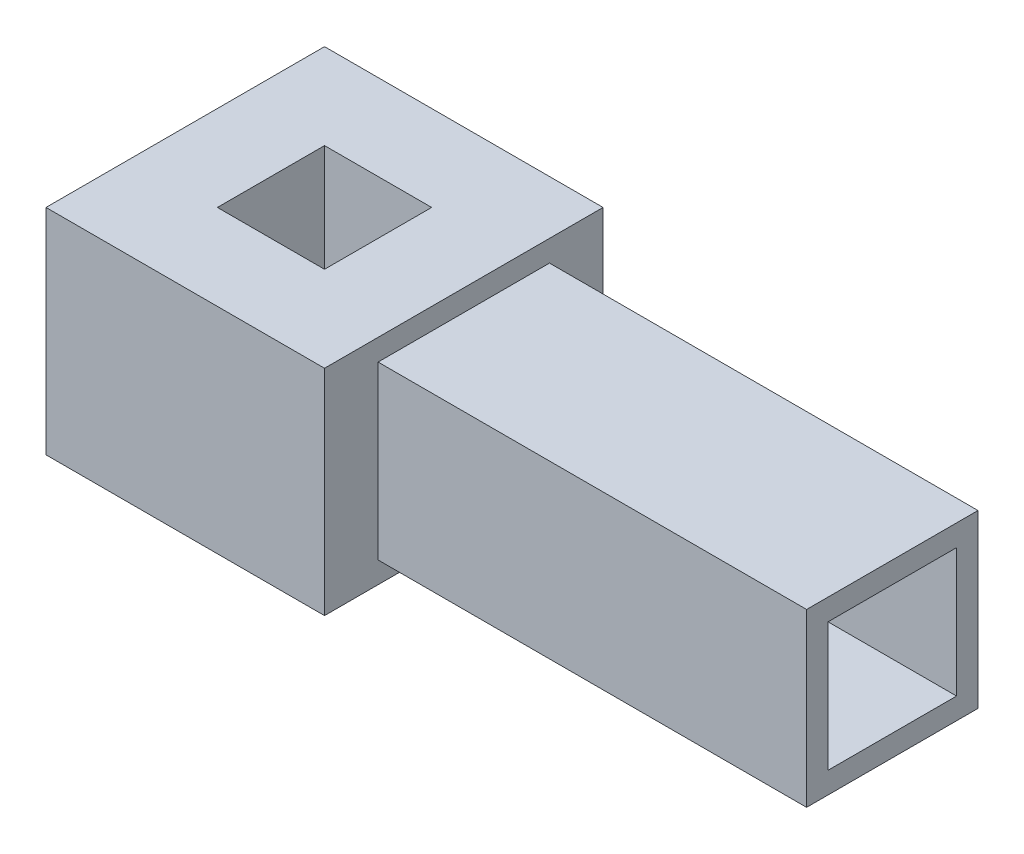
from build123d import *

# Parameters (mm, degrees)
SKETCH1_W           = 65
SKETCH1_H           = 65
SKETCH1_W_2         = 25
SKETCH1_H_2         = 25
BOSS_EXTRUDE1_DEPTH = 50
SKETCH2_W           = 40
SKETCH2_H           = 40
SKETCH2_W_2         = 30
SKETCH2_H_2         = 30
BOSS_EXTRUDE2_DEPTH = 100


with BuildPart() as part:
    # Sketch1 → Boss-Extrude1 (new body)
    with BuildSketch(Plane(origin=(0, 0, 0), x_dir=(1, 0, 0), z_dir=(0, 1, 0))):
        Rectangle(SKETCH1_W, SKETCH1_H)
        Rectangle(SKETCH1_W_2, SKETCH1_H_2, mode=Mode.SUBTRACT)
    extrude(amount=BOSS_EXTRUDE1_DEPTH)

    # Sketch2 → Boss-Extrude2 (add)
    with BuildSketch(Plane(origin=(32.5, 0, 0), x_dir=(0, 0, -1), z_dir=(1, 0, 0))):
        with Locations((0, 25)):
            Rectangle(SKETCH2_W, SKETCH2_H)
        with Locations((0, 25)):
            Rectangle(SKETCH2_W_2, SKETCH2_H_2, mode=Mode.SUBTRACT)
    extrude(amount=BOSS_EXTRUDE2_DEPTH)


solid = part.part
